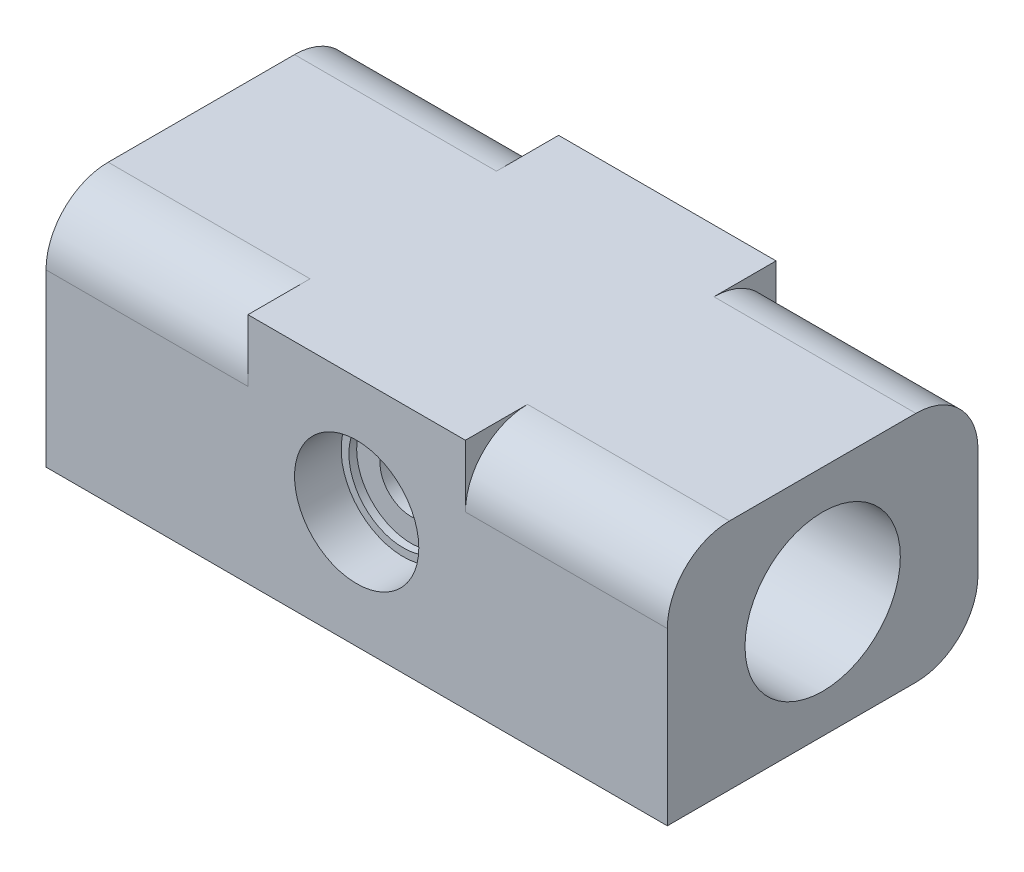
from build123d import *

# Parameters (mm, degrees)
SKETCH_1_W          = 20
SKETCH_1_H          = 15
SKETCH_1_R          = 5
EXTRUDE_1_DEPTH     = 40
SKETCH_2_R          = 4
CUT_EXTRUDE_1_DEPTH = 3
SKETCH_3_R          = 2
CUT_EXTRUDE_2_DEPTH = 45.10498838
SKETCH_4_W          = 26.593745906
SKETCH_4_H          = 18.404579196
CUT_EXTRUDE_3_DEPTH = 13
SKETCH_5_R          = 3.5
CUT_EXTRUDE_4_DEPTH = 0.5
CUT_EXTRUDE_5_DEPTH = 6


with BuildPart() as part:
    # 草圖1 → 填料-伸長1 (new body)
    with BuildSketch(Plane(origin=(0, 0, 0), x_dir=(0, 0, -1), z_dir=(1, 0, 0))):
        Rectangle(SKETCH_1_W, SKETCH_1_H)
        Circle(SKETCH_1_R, mode=Mode.SUBTRACT)
    extrude(amount=EXTRUDE_1_DEPTH)

    # 草圖2 → 除料-伸長1 (cut)
    with BuildSketch(Plane.XY.offset(10)):
        with Locations((20, 0)):
            Circle(SKETCH_2_R)
    cut_extrude_1 = extrude(amount=-CUT_EXTRUDE_1_DEPTH, mode=Mode.SUBTRACT)

    # 鏡射1: 除料-伸長1 across plane
    add(cut_extrude_1.mirror(Plane.XY), mode=Mode.SUBTRACT)

    # 草圖3 → 除料-伸長2 (cut, through all)
    with BuildSketch(Plane.XY.offset(7)):
        with Locations(Location((20, 0, 0), (0, 0, 179.999999998))):
            Circle(SKETCH_3_R)
    extrude(amount=-CUT_EXTRUDE_2_DEPTH, mode=Mode.SUBTRACT)

    # 草圖4 → 除料-伸長3 (cut)
    with BuildSketch(Plane.ZY):
        Rectangle(SKETCH_4_W, SKETCH_4_H)
        with BuildLine():
            Line((-6, 7.5), (6, 7.5))
            ThreePointArc((6, 7.5), (8.828427125, 6.328427125), (10, 3.5))
            Line((10, 3.5), (10, -7.5))
            Line((10, -7.5), (-6, -7.5))
            ThreePointArc((-6, -7.5), (-8.828427125, -6.328427125), (-10, -3.5))
            Line((-10, -3.5), (-10, 3.5))
            ThreePointArc((-10, 3.5), (-8.828427125, 6.328427125), (-6, 7.5))
        make_face(mode=Mode.SUBTRACT)
    cut_extrude_3 = extrude(amount=-CUT_EXTRUDE_3_DEPTH, mode=Mode.SUBTRACT)

    # 鏡射2: 除料-伸長3 across plane
    add(cut_extrude_3.mirror(Plane(origin=(20, 0, 0), x_dir=(0, 0, 1), z_dir=(1, 0, 0))), mode=Mode.SUBTRACT)

    # 草圖5 → 除料-伸長4 (cut)
    with BuildSketch(Plane(origin=(0, 0, -7), x_dir=(-1, 0, 0), z_dir=(0, 0, -1))):
        with Locations((-20, 0)):
            Circle(SKETCH_5_R)
    cut_extrude_4 = extrude(amount=-CUT_EXTRUDE_4_DEPTH, mode=Mode.SUBTRACT)

    # 鏡射3: 除料-伸長4 across plane
    add(cut_extrude_4.mirror(Plane.XY), mode=Mode.SUBTRACT)

    # 草圖6 → 除料-伸長5 (cut)
    with BuildSketch(Plane.XY.offset(-10)):
        with BuildLine():
            Line((15.669872981, -7.5), (24.330127019, -7.5))
            Line((24.330127019, -7.5), (33.279056191, -7.5))
            Line((33.279056191, -7.5), (30.418218618, -2.544883972))
            Line((30.418218618, -2.544883972), (27.729646072, -1.888139721))
            Line((27.729646072, -1.888139721), (22.75, -4.763139721))
            ThreePointArc((22.75, -4.763139721), (20, -5.5), (17.25, -4.763139721))
            Line((17.25, -4.763139721), (12.270353928, -1.888139721))
            Line((12.270353928, -1.888139721), (9.581781382, -2.544883972))
            Line((9.581781382, -2.544883972), (6.720943809, -7.5))
            Line((6.720943809, -7.5), (15.669872981, -7.5))
        make_face()
    extrude(amount=CUT_EXTRUDE_5_DEPTH, mode=Mode.SUBTRACT)


solid = part.part
